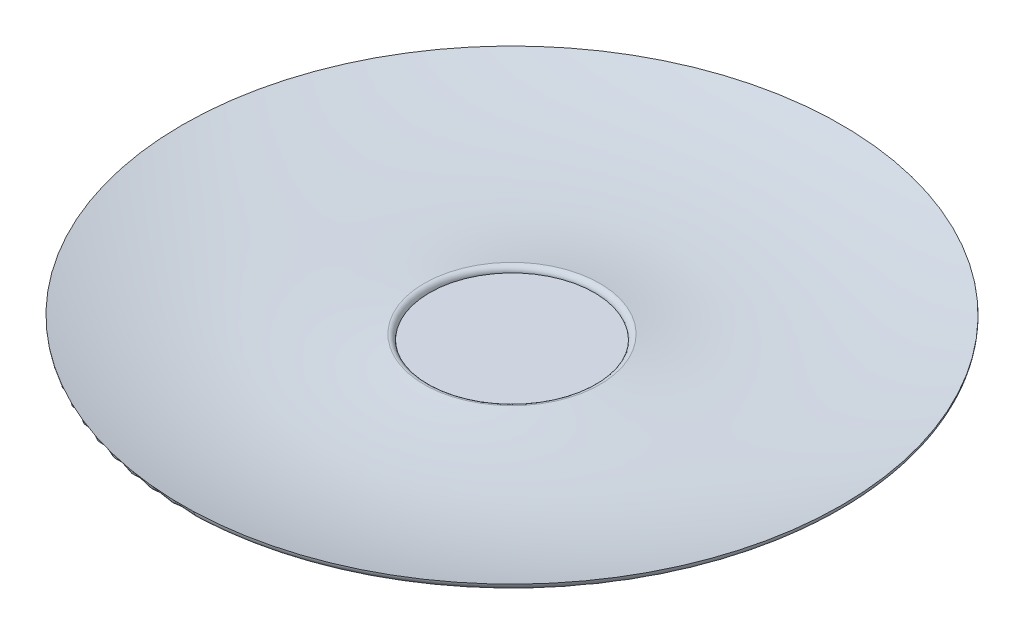
from build123d import *


with BuildPart() as part:
    # Sketch2 → Revolve2 (revolve)
    with BuildSketch(Plane.XY, mode=Mode.PRIVATE) as revolve2_sk:
        with BuildLine():
            Line((0, 0), (20, 0))
            ThreePointArc((20, 0), (20.382866953, 0.92432259), (21.307189542, 1.307189542))
            add(Edge.make_bspline(
                [(21.307189542, 1.307189542), (50.589297326, -3.648702918), (80, 5.283333405)],
                knots=[0, 0, 0, 1, 1, 1], degree=2))
            ThreePointArc((80, 5.283333405), (79.644135668, 4.296719594), (78.771253816, 3.715235711))
            Line((78.771253816, 3.715235711), (66.216017581, -0.934527379))
            add(Edge.make_bspline(
                [(16, -9.716666595), (31.973399001, -2.802481332), (50.081212283, -7.497100863), (66.216017581, -0.934527379)],
                knots=[0, 0, 0, 0, 1, 1, 1, 1], degree=3))
            Line((16, -9.716666595), (0, -9.716666595))
            Line((0, -9.716666595), (0, 0))
        make_face()
    revolve(revolve2_sk.sketch.rotate(Axis((0, 0, 0), (0, -1, 0)), 180), axis=Axis((0, 0, 0), (0, -1, 0)))


solid = part.part
